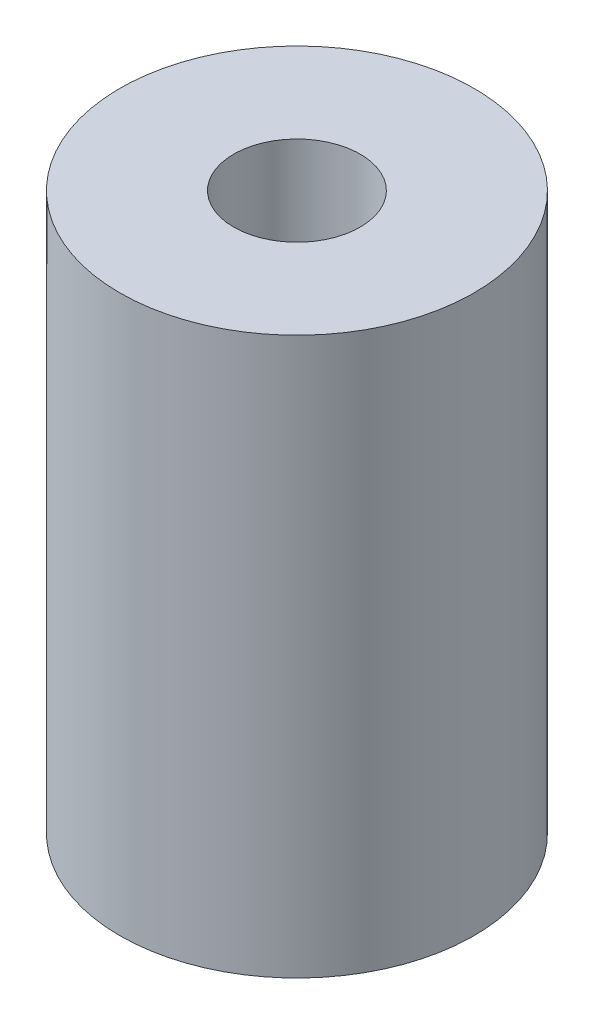
from build123d import *

# Parameters (mm, degrees)
SKETCH_1_R          = 7
EXTRUDE_1_DEPTH     = 22
SKETCH_2_R          = 2.5
CUT_EXTRUDE_2_DEPTH = 22
SKETCH_3_R          = 3
CUT_EXTRUDE_3_DEPTH = 11


with BuildPart() as part:
    # 草图1 → 凸台-拉伸1 (new body)
    with BuildSketch(Plane(origin=(0, 0, 0), x_dir=(1, 0, 0), z_dir=(0, 1, 0))):
        with Locations(Location((0, 0, 0), (0, 0, 270))):
            Circle(SKETCH_1_R)
    extrude(amount=EXTRUDE_1_DEPTH)

    # 草图2 → 切除-拉伸2 (cut)
    with BuildSketch(Plane(origin=(0, 22, 0), x_dir=(1, 0, 0), z_dir=(0, 1, 0))):
        with Locations(Location((0, 0, 0), (0, 0, 270))):
            Circle(SKETCH_2_R)
    extrude(amount=-CUT_EXTRUDE_2_DEPTH, mode=Mode.SUBTRACT)

    # 草图3 → 切除-拉伸3 (cut)
    with BuildSketch(Plane.XZ):
        with Locations(Location((0, 0, 0), (0, 0, 270))):
            Circle(SKETCH_3_R)
    extrude(amount=-CUT_EXTRUDE_3_DEPTH, mode=Mode.SUBTRACT)


solid = part.part
